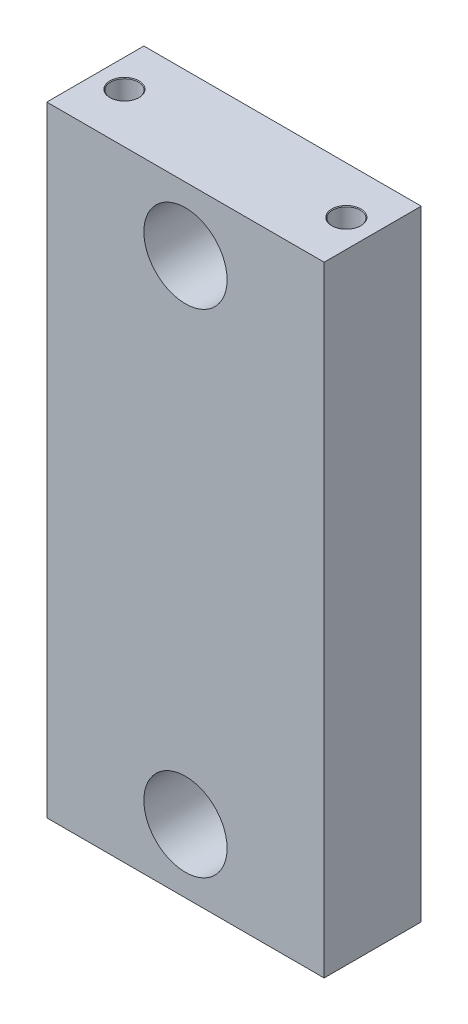
from build123d import *

# Parameters (mm, degrees)
SKETCH2_W                       = 10
SKETCH2_H                       = 22.35
SKETCH2_R                       = 1.5
BOSS_EXTRUDE1_DEPTH             = 3.5
F_1_0MM_DOWEL_HOLE1_D           = 1
F_1_0MM_DOWEL_HOLE1_DEPTH       = 3
F_1_0MM_DOWEL_HOLE1_CSINK_D     = 1.05
F_1_0MM_DOWEL_HOLE1_CSINK_ANGLE = 90
F_1_0MM_DOWEL_HOLE1_TIP         = 0.30043031


with BuildPart() as part:
    # Sketch2 → Boss-Extrude1 (new body)
    with BuildSketch(Plane.XY):
        with Locations((0, -16.175)):
            Rectangle(SKETCH2_W, SKETCH2_H)
        with Locations((0, -7.3)):
            Circle(SKETCH2_R, mode=Mode.SUBTRACT)
        with Locations((0, -25.05)):
            Circle(SKETCH2_R, mode=Mode.SUBTRACT)
    extrude(amount=BOSS_EXTRUDE1_DEPTH)

    # Ø1.0mm Dowel Hole1
    with Locations(Plane(origin=(-4, -5, 1.7), x_dir=(1, 0, 0), z_dir=(0, 1, 0))):
        with Locations((0, 0), (8, 0)):
            CounterSinkHole(F_1_0MM_DOWEL_HOLE1_D / 2, F_1_0MM_DOWEL_HOLE1_CSINK_D / 2, depth=F_1_0MM_DOWEL_HOLE1_DEPTH, counter_sink_angle=F_1_0MM_DOWEL_HOLE1_CSINK_ANGLE)
            with Locations((0, 0, -(F_1_0MM_DOWEL_HOLE1_DEPTH + F_1_0MM_DOWEL_HOLE1_TIP / 2))):  # 118° drill point
                Cone(0, F_1_0MM_DOWEL_HOLE1_D / 2, F_1_0MM_DOWEL_HOLE1_TIP, mode=Mode.SUBTRACT)


solid = part.part
